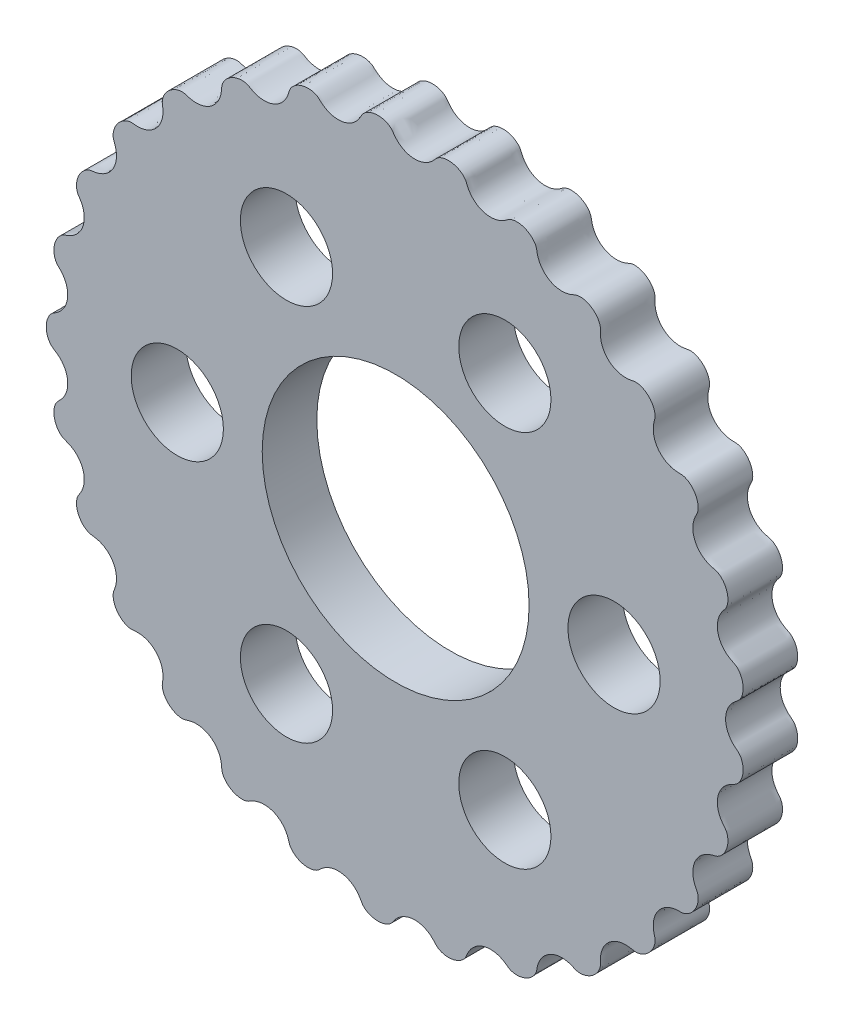
from build123d import *

# Parameters (mm, degrees)
SKETCH1_R           = 6.0325
SKETCH1_R_2         = 17.4625
BOSS_EXTRUDE1_DEPTH = 7.14375


with BuildPart() as part:
    # Sketch1 → Boss-Extrude1 (new body)
    with BuildSketch(Plane.XY):
        with BuildLine():
            add(Edge.make_bspline(
                [(43.180037539, -0.016171008), (43.180732256, -0.156720525), (43.198547592, -0.441775025), (43.275571177, -0.866849268), (43.475929503, -1.408463048), (43.758194206, -1.88996266), (44.060073392, -2.254524653), (44.342588939, -2.520531204), (44.577640295, -2.712775103), (44.773247465, -2.856854457), (44.992820418, -3.068793424), (45.176258671, -3.348075236), (45.323218913, -3.677104963), (45.446017109, -4.137904281), (45.494569855, -4.664468754), (45.431104619, -5.27645532), (45.238531318, -5.829854326), (45.002248244, -6.231904135), (44.776137553, -6.500833359), (44.602340139, -6.664063371), (44.406139199, -6.800841403), (44.189763607, -6.900940102), (43.922438765, -7.030624346), (43.654205093, -7.182908207), (43.392247616, -7.365298095), (43.088404259, -7.625181377), (42.70406512, -8.035675702), (42.358871835, -8.592317431), (42.126606325, -9.298133027), (42.069815968, -10.051474516), (42.143213989, -10.678161981), (42.323125901, -11.244812552), (42.551667666, -11.685704502), (42.778586883, -12.013421918), (42.966396025, -12.249241998), (43.125490848, -12.430917876), (43.288651248, -12.686394764), (43.434807344, -13.076931442), (43.511212195, -13.602534957), (43.456364105, -14.24321268), (43.241807953, -14.901984846), (42.943943747, -15.395026555), (42.637096026, -15.733726316), (42.370967555, -15.946365614), (42.18019639, -16.067151779), (41.975201436, -16.163357733), (41.75693081, -16.223190355), (41.536749446, -16.269477814), (41.319039979, -16.329376208), (41.092393187, -16.402087549), (40.859376877, -16.494977167), (40.560182248, -16.640203587), (40.208696047, -16.860549752), (39.837162952, -17.17242085), (39.459674393, -17.616681783), (39.153218052, -18.147312364), (38.944862936, -18.754876245), (38.860039402, -19.420822348), (38.90782701, -20.038909848), (39.035303108, -20.532258893), (39.184960629, -20.90196683), (39.309527718, -21.163729143), (39.421857135, -21.366392051), (39.533723451, -21.635210453), (39.590771181, -21.954987961), (39.594749909, -22.310994211), (39.523141254, -22.784796196), (39.348356968, -23.304571584), (39.023432953, -23.861891973), (38.602130802, -24.2956395), (38.211782612, -24.560225746), (37.906644131, -24.699926834), (37.715364341, -24.764840019), (37.517444484, -24.807630002), (37.315495158, -24.819414311), (37.114050768, -24.818030604), (36.912270333, -24.826223534), (36.627508265, -24.847246342), (36.261943448, -24.905890125), (35.824449931, -25.031540876), (35.336442821, -25.262068329), (34.866959237, -25.586186863), (34.439228163, -26.010514916), (34.081545485, -26.534354875), (33.856709216, -27.071582238), (33.74423218, -27.556088346), (33.706283949, -27.949117586), (33.70515751, -28.241561548), (33.724901916, -28.514933397), (33.76342912, -28.765873295), (33.814351358, -29.016006605), (33.883015979, -29.259962141), (33.943683971, -29.508246913), (33.953967622, -29.763845838), (33.926956816, -30.043402736), (33.856082579, -30.342474375), (33.706023606, -30.738100741), (33.436656103, -31.190671854), (33.033577179, -31.64043598), (32.570481269, -31.967121435), (32.172859705, -32.150128356), (31.862252234, -32.240651261), (31.655025839, -32.279924593), (31.444627822, -32.296721439), (31.23344544, -32.285248795), (31.026921352, -32.241999931), (30.820971552, -32.199341196), (30.600556674, -32.16287516), (30.366331589, -32.137015664), (30.052902657, -32.123555765), (29.661570124, -32.145590456), (29.211244124, -32.230269416), (28.688035269, -32.417551592), (28.176141949, -32.708112214), (27.701477403, -33.10983214), (27.346943319, -33.558754963), (27.110774429, -33.987066661), (26.944807526, -34.413463491), (26.835879347, -34.827558732), (26.788453638, -35.237853757), (26.784653574, -35.634946058), (26.808678636, -35.964618424), (26.793027936, -36.229931722), (26.719827199, -36.516728997), (26.594862869, -36.817200298), (26.41061149, -37.12218318), (26.166767262, -37.421159853), (25.892392942, -37.677747723), (25.596889536, -37.892495081), (25.287182018, -38.065259494), (24.968793214, -38.197253322), (24.637259251, -38.28933846), (24.295697914, -38.338192219), (23.951971334, -38.335510804), (23.610281781, -38.2743009), (23.315072265, -38.129974817), (23.030874128, -38.009916087), (22.688143252, -37.891707421), (22.284557779, -37.797197289), (21.801592317, -37.750627619), (21.212904977, -37.792398503), (20.605939892, -37.949484152), (20.008727748, -38.239540897), (19.526846468, -38.617479187), (19.178810079, -39.007912737), (18.947932632, -39.353522655), (18.80239977, -39.62600896), (18.660863561, -39.953966538), (18.561357778, -40.277229296), (18.489927946, -40.6070512), (18.440677767, -40.941313977), (18.354332871, -41.198930907), (18.207728603, -41.467582588), (18.002695856, -41.740027329), (17.733567501, -42.00331966), (17.40084439, -42.244704065), (16.957255124, -42.479489789), (16.483479522, -42.631888281), (15.99631956, -42.69784861), (15.542982384, -42.672876852), (15.223330542, -42.606950322), (14.944812927, -42.504870099), (14.716213267, -42.367922077), (14.509218278, -42.202328474), (14.289692169, -42.053483722), (14.063745742, -41.914887442), (13.826950132, -41.79510958), (13.568328375, -41.686718641), (13.286832851, -41.596277845), (12.903718763, -41.510579536), (12.415425206, -41.467308184), (11.843432661, -41.51167776), (11.244603196, -41.682261887), (10.718022482, -41.945766829), (10.271629738, -42.275557887), (9.951157305, -42.601373684), (9.71527865, -42.913017879), (9.551931662, -43.17983187), (9.442973852, -43.387921897), (9.350192269, -43.590358043), (9.270616777, -43.784203123), (9.189982201, -43.978429963), (9.079982843, -44.158192239), (8.947815845, -44.321717357), (8.798926417, -44.470089616), (8.549980836, -44.674906608), (8.176039539, -44.899769579), (7.646366587, -45.098646483), (7.047915931, -45.17922452), (6.521998337, -45.147375771), (6.046765759, -45.033795333), (5.7039521, -44.888128032), (5.412591508, -44.696704275), (5.197664214, -44.458546216), (5.034301852, -44.264448841), (4.854457741, -44.081900373), (4.667786905, -43.909209119), (4.451308161, -43.739682049), (4.207535591, -43.576870138), (3.859254952, -43.388478824), (3.393149504, -43.211079404), (2.820196018, -43.097982629), (2.184979426, -43.103322055), (1.594300057, -43.222371866), (1.064432533, -43.431479243), (0.602495875, -43.707243919), (0.255268685, -43.999288892), (0.003264965, -44.268907232), (-0.172736489, -44.492621654), (-0.292127839, -44.654659877), (-0.403519112, -44.821813054), (-0.527320348, -44.981011935), (-0.674103885, -45.119552691), (-0.83516208, -45.240392421), (-1.121726033, -45.41305447), (-1.558791141, -45.586100315), (-2.153586466, -45.690385536), (-2.796737391, -45.645822554), (-3.325328371, -45.498030344), (-3.758409828, -45.289965509), (-4.051277822, -45.085597139), (-4.283528187, -44.857229089), (-4.442571331, -44.612217185), (-4.546898542, -44.40469493), (-4.666176505, -44.204802082), (-4.792023432, -44.009416939), (-4.99663872, -43.73559526), (-5.303181449, -43.40394273), (-5.745653731, -43.054994921), (-6.347098729, -42.753213686), (-6.968997495, -42.587810385), (-7.580364356, -42.546918667), (-8.158901061, -42.613055327), (-8.623451492, -42.747325637), (-9.001288501, -42.915719611), (-9.287868995, -43.082449393), (-9.494419501, -43.223446777), (-9.680710334, -43.370382107), (-9.851693649, -43.516689999), (-10.01266255, -43.672906463), (-10.185226637, -43.818254388), (-10.379822164, -43.932471103), (-10.586587837, -44.021459188), (-10.829539238, -44.095992259), (-11.107937654, -44.148356665), (-11.50474109, -44.176026154), (-12.019279583, -44.128864319), (-12.602129156, -43.959887322), (-13.163530105, -43.64456311), (-13.555877247, -43.284432842), (-13.796634042, -42.94254654), (-13.914977796, -42.662733731), (-13.975956971, -42.428578463), (-14.066516097, -42.140285409), (-14.211734025, -41.767928489), (-14.450516805, -41.330783639), (-14.8215104, -40.863806074), (-15.302532397, -40.452116816), (-15.951915969, -40.084280412), (-16.651730137, -39.885620849), (-17.35511176, -39.853345855), (-17.947165062, -39.955679245), (-18.317756531, -40.070765846), (-18.605284355, -40.19029888), (-18.815703294, -40.29522275), (-19.022261204, -40.407437888), (-19.22099941, -40.533354976), (-19.489877553, -40.655543439), (-19.811544832, -40.726082278), (-20.172572708, -40.744015649), (-20.655997473, -40.690097459), (-21.184599966, -40.534140114), (-21.751983016, -40.231498845), (-22.24871682, -39.784885468), (-22.555614534, -39.33887883), (-22.710618323, -38.952301006), (-22.761786732, -38.664098975), (-22.769100022, -38.430935469), (-22.791665739, -38.199140048), (-22.821556602, -37.968019918), (-22.885272245, -37.650591129), (-23.005748151, -37.253573401), (-23.220131195, -36.793697715), (-23.565769264, -36.305495121), (-24.094818523, -35.789859648), (-24.730837757, -35.414231996), (-25.433464775, -35.201077776), (-26.13317853, -35.157872253), (-26.602784484, -35.204568044), (-26.980172383, -35.289886774), (-27.270319444, -35.376897065), (-27.498871758, -35.457674538), (-27.797234291, -35.518256805), (-28.130348001, -35.512261831), (-28.484034056, -35.448394361), (-28.932712272, -35.291041267), (-29.39493714, -35.035378795), (-29.865560066, -34.638748932), (-30.215252137, -34.167768335), (-30.415116481, -33.744934569), (-30.509985155, -33.405648377), (-30.546818086, -33.16944569), (-30.548370037, -32.92969174), (-30.509038093, -32.694009025), (-30.466816428, -32.399129153), (-30.442999743, -32.090761089), (-30.447963238, -31.770632214), (-30.494083089, -31.372144448), (-30.620807279, -30.822151469), (-30.891215717, -30.224121257), (-31.348446993, -29.63776838), (-31.942064335, -29.171451668), (-32.501334301, -28.884042602), (-33.070129399, -28.717654752), (-33.5619975, -28.661143206), (-33.959518376, -28.666020427), (-34.259349803, -28.689663621), (-34.498573325, -28.719014801), (-34.800859124, -28.708768614), (-35.204676688, -28.609495771), (-35.680722167, -28.377264603), (-36.179010237, -27.972171902), (-36.603258711, -27.424331219), (-36.843757021, -26.900052702), (-36.951248767, -26.454299667), (-36.976886001, -26.113507364), (-36.96884724, -25.887097507), (-36.932077181, -25.662867601), (-36.857281806, -25.448470733), (-36.772442124, -25.239359931), (-36.699785817, -25.024745341), (-36.614237703, -24.728919287), (-36.541184271, -24.345182483), (-36.512950635, -23.872361671), (-36.572531388, -23.319618487), (-36.724626395, -22.782320994), (-36.966872183, -22.276329711), (-37.29365344, -21.817136746), (-37.69641591, -21.418921273), (-38.157695082, -21.098354611), (-38.661836076, -20.860853315), (-39.127609879, -20.728516332), (-39.532268319, -20.663148513), (-39.872442624, -20.631717807), (-40.137980324, -20.560920441), (-40.409501926, -20.431993437), (-40.681841236, -20.252019741), (-40.945365601, -20.016779468), (-41.191061737, -19.728198567), (-41.43631476, -19.348971614), (-41.648573663, -18.86867991), (-41.75769213, -18.393863753), (-41.775191398, -17.948366049), (-41.737324922, -17.618251361), (-41.689799532, -17.403228614), (-41.617456128, -17.194769573), (-41.513994331, -16.999783372), (-41.387377102, -16.819611474), (-41.270936214, -16.633230895), (-41.154578009, -16.432065871), (-41.046154904, -16.212550768), (-40.922884701, -15.912090838), (-40.809057944, -15.523220987), (-40.738194022, -15.054837461), (-40.745999695, -14.483513178), (-40.860279597, -13.892032203), (-41.095833989, -13.304095214), (-41.415625027, -12.819321102), (-41.754096485, -12.456720677), (-42.058173371, -12.206511163), (-42.299538017, -12.042781671), (-42.536602293, -11.906640089), (-42.765740028, -11.798853542), (-43.000780884, -11.701010479), (-43.24093738, -11.621959268), (-43.479340465, -11.531620295), (-43.695438614, -11.396020737), (-43.910506156, -11.216552759), (-44.117118209, -10.990143107), (-44.359040339, -10.644407669), (-44.581619193, -10.167647422), (-44.727121043, -9.581119357), (-44.737690285, -8.960559315), (-44.643774815, -8.476328513), (-44.505062643, -8.124377526), (-44.373426599, -7.894913072), (-44.244006528, -7.726968739), (-44.091382363, -7.580485398), (-43.940485278, -7.433279802), (-43.786347032, -7.270566105), (-43.633664803, -7.090174521), (-43.446749007, -6.836853072), (-43.245989981, -6.498634037), (-43.064494532, -6.076064636), (-42.928353108, -5.536322454), (-42.884569294, -4.949193975), (-42.953787213, -4.332185716), (-43.128274442, -3.788837521), (-43.351563054, -3.35532587), (-43.574189666, -3.03442787), (-43.762980005, -2.8088328), (-43.959659448, -2.610872873), (-44.158597212, -2.437253557), (-44.370729753, -2.280350737), (-44.589717627, -2.133210944), (-44.819237553, -2.00279529), (-45.027946151, -1.839150875), (-45.223290975, -1.61799747), (-45.400414328, -1.345864091), (-45.548580497, -1.022906653), (-45.662830498, -0.638584407), (-45.707797041, -0.33672715), (-45.719322165, -0.128747099), (-45.719945311, -0.016648341), (-45.719960735, -0.01387366), (-45.719972737, -0.011098961), (-45.719989886, -0.005549522), (-45.719993317, 0), (-45.719989889, 0.005549521), (-45.719972742, 0.01109896), (-45.719960743, 0.01387366), (-45.71994532, 0.01664834), (-45.719322229, 0.128747622), (-45.707797135, 0.336728202), (-45.662830533, 0.638585986), (-45.548580314, 1.022908715), (-45.400414087, 1.345866127), (-45.223290685, 1.617999474), (-45.027945822, 1.839152844), (-44.819237194, 2.002797221), (-44.589717244, 2.133212834), (-44.370729345, 2.280352588), (-44.158596776, 2.43725537), (-43.95965898, 2.610874651), (-43.762979502, 2.808834542), (-43.574189122, 3.034429579), (-43.351562452, 3.355327539), (-43.128273763, 3.788839149), (-42.953786437, 4.332187313), (-42.884568407, 4.949195559), (-42.928352116, 5.536324046), (-43.064493443, 6.076066253), (-43.245988816, 6.498635687), (-43.446747781, 6.836854757), (-43.633663532, 7.09017624), (-43.786345729, 7.270567851), (-43.940483946, 7.433281576), (-44.091381004, 7.580487198), (-44.244005143, 7.726970567), (-44.373425184, 7.894914924), (-44.505061187, 8.124379401), (-44.643773296, 8.476330413), (-44.737688679, 8.960561232), (-44.727119326, 9.581121271), (-44.581617371, 10.167649311), (-44.359038431, 10.644409518), (-44.117116239, 10.990144912), (-43.910504146, 11.216554527), (-43.695436571, 11.396022467), (-43.479338398, 11.531621986), (-43.240935297, 11.621960917), (-43.000778786, 11.701012084), (-42.765737914, 11.798855105), (-42.536600159, 11.906641611), (-42.299535859, 12.042783151), (-42.058171183, 12.2065126), (-41.754094252, 12.456722059), (-41.415622729, 12.819322423), (-41.095831604, 13.304096478), (-40.860277107, 13.892033425), (-40.745997099, 14.48351438), (-40.738191324, 15.054838661), (-40.809055161, 15.523222199), (-40.922881849, 15.912092071), (-41.046151998, 16.212552023), (-41.154575063, 16.432067146), (-41.270933233, 16.63323219), (-41.387374087, 16.81961279), (-41.513991284, 16.999784711), (-41.617453046, 17.19477093), (-41.689796413, 17.403229985), (-41.737321764, 17.61825274), (-41.775188181, 17.948367435), (-41.757688833, 18.393865135), (-41.648570281, 18.868681273), (-41.436311292, 19.348972939), (-41.191058201, 19.728199848), (-40.945362013, 20.016780705), (-40.681837606, 20.252020931), (-40.409498264, 20.431994578), (-40.137976639, 20.560921533), (-39.872438926, 20.631718852), (-39.532264616, 20.663149497), (-39.127606164, 20.728517243), (-38.661832337, 20.860854143), (-38.1576913, 21.098355349), (-37.696412071, 21.418921928), (-37.293649529, 21.817137329), (-36.966868191, 22.276330234), (-36.724622312, 22.782321475), (-36.572527208, 23.31961894), (-36.512946356, 23.872362113), (-36.541179907, 24.345182931), (-36.61423327, 24.728919748), (-36.699781331, 25.024745817), (-36.7724376, 25.23936042), (-36.857277244, 25.448471237), (-36.932072581, 25.662868119), (-36.9688426, 25.887098031), (-36.976881321, 26.11350789), (-36.951244025, 26.454300188), (-36.843752199, 26.900053204), (-36.603253796, 27.424331678), (-36.179005223, 27.972172285), (-35.680717081, 28.377264896), (-35.20467156, 28.60949598), (-34.800853979, 28.70876875), (-34.498568177, 28.719014883), (-34.25934466, 28.68966366), (-33.959513238, 28.666020412), (-33.561992363, 28.661143119), (-33.070124251, 28.717654577), (-32.501329124, 28.884042325), (-31.942059107, 29.171451291), (-31.348441681, 29.637767897), (-30.891210299, 30.224120692), (-30.620801755, 30.822150856), (-30.494077466, 31.372143812), (-30.447957543, 31.770631569), (-30.442993991, 32.090760444), (-30.466810621, 32.399128512), (-30.509032233, 32.694008392), (-30.548364135, 32.929691113), (-30.546812141, 33.169445063), (-30.509979167, 33.405647744), (-30.415110433, 33.744933919), (-30.215246012, 34.167767649), (-29.865553857, 34.638748183), (-29.39493086, 35.035377962), (-28.932705946, 35.291040351), (-28.484027702, 35.448393364), (-28.130341636, 35.512260771), (-27.797227925, 35.518255686), (-27.498865402, 35.457673364), (-27.270313103, 35.376895851), (-26.980166057, 35.289885508), (-26.602778174, 35.20456671), (-26.133172228, 35.157870835), (-25.433458466, 35.201076232), (-24.730831409, 35.414230327), (-24.094812108, 35.789857864), (-23.565762756, 36.305493243), (-23.2201246, 36.793695775), (-23.005741474, 37.253571423), (-22.885265496, 37.650589129), (-22.821549797, 37.968017907), (-22.791658892, 38.199138032), (-22.769093134, 38.430933449), (-22.761779802, 38.664096953), (-22.710611341, 38.952298974), (-22.555607483, 39.338876771), (-22.248709689, 39.784883354), (-21.751975805, 40.231496641), (-21.184592701, 40.534137809), (-20.65599018, 40.690095059), (-20.172565405, 40.744013162), (-19.811537532, 40.726079727), (-19.489870266, 40.655540831), (-19.220992145, 40.53335232), (-19.022253961, 40.407435196), (-18.815696072, 40.29522002), (-18.605277151, 40.190296113), (-18.317749349, 40.070763028), (-17.9471579, 39.95567636), (-17.355104617, 39.853342863), (-16.651722988, 39.885617732), (-15.951908784, 40.084277169), (-15.302525147, 40.452113457), (-14.821503076, 40.863802628), (-14.450509396, 41.330780127), (-14.211726539, 41.767924935), (-14.066508544, 42.140281828), (-13.975949367, 42.428574866), (-13.91497015, 42.662730123), (-13.796626345, 42.942542911), (-13.555869489, 43.28442917), (-13.163522283, 43.644559368), (-12.602121277, 43.959883479), (-12.019271674, 44.128860372), (-11.504733172, 44.176022114), (-11.107929741, 44.148352554), (-10.829531334, 44.095988098), (-10.586579947, 44.021454984), (-10.379814289, 43.932466862), (-10.185218783, 43.818250112), (-10.012654722, 43.672902156), (-9.851685849, 43.516685663), (-9.68070256, 43.37037774), (-9.494411754, 43.223442377), (-9.287861273, 43.082444956), (-9.001280809, 42.915715123), (-8.62344383, 42.747321081), (-8.158893423, 42.613050688), (-7.58035673, 42.546913924), (-6.968989861, 42.587805532), (-6.347091066, 42.753208722), (-5.745646014, 43.054989849), (-5.303173669, 43.403937579), (-4.99663088, 43.735590053), (-4.792015544, 44.009411696), (-4.666168582, 44.204796817), (-4.546890583, 44.404689643), (-4.442563335, 44.612211879), (-4.283520147, 44.857223755), (-4.051269741, 45.085591763), (-3.75840171, 45.28996008), (-3.325320216, 45.498024838), (-2.796729209, 45.645816954), (-2.153578277, 45.69037982), (-1.55878297, 45.586094493), (-1.121717893, 45.413048569), (-0.835153971, 45.240386469), (-0.674095798, 45.11954671), (-0.527312286, 44.981005927), (-0.403511079, 44.821807024), (-0.292119835, 44.654653827), (-0.172728514, 44.492615583), (0.0032729, 44.26890113), (0.255276571, 43.999282744), (0.602503709, 43.707237709), (1.064440317, 43.43147295), (1.594307804, 43.222365478), (2.184987152, 43.103315562), (2.820203743, 43.097976021), (3.393157249, 43.211072694), (3.859262729, 43.388472031), (4.207543401, 43.576863282), (4.451316001, 43.739675149), (4.667794776, 43.909202181), (4.854465642, 44.081893401), (5.034309786, 44.264441837), (5.197672183, 44.458539182), (5.41259952, 44.696697203), (5.703960146, 44.888120908), (6.046773831, 45.033788147), (6.522006429, 45.1473685), (7.047924029, 45.179217155), (7.64637467, 45.098639011), (8.176047587, 44.899762011), (8.549988844, 44.674898973), (8.798934388, 44.470081937), (8.947823789, 44.321709651), (9.079990758, 44.158184509), (9.189990084, 43.978422214), (9.270624625, 43.784195359), (9.350200082, 43.590350265), (9.442981629, 43.387914103), (9.551939402, 43.179824056), (9.715286342, 42.913010036), (9.951164941, 42.601365799), (10.271637316, 42.275549944), (10.718030001, 41.945758806), (11.244610667, 41.68225377), (11.843440101, 41.511669535), (12.415432639, 41.467299856), (12.903726203, 41.510571121), (13.286840307, 41.596269362), (13.568335847, 41.686710107), (13.826957623, 41.795101), (14.063753255, 41.914878819), (14.289699706, 42.053475058), (14.509225842, 42.202319772), (14.716220861, 42.367913338), (14.944820545, 42.504861318), (15.223338179, 42.606941492), (15.542990032, 42.672867964), (15.996327214, 42.697839641), (16.483487164, 42.631879225), (16.957262738, 42.479480648), (17.400851962, 42.244694844), (17.73357503, 42.003310379), (18.002703337, 41.740018), (18.207736036, 41.467573223), (18.354340256, 41.198921515), (18.440685105, 40.94130457), (18.489935224, 40.607041784), (18.561364997, 40.277219867), (18.660870722, 39.953957091), (18.802406872, 39.625999488), (18.947939686, 39.353513157), (19.178817071, 39.007903197), (19.52685339, 38.617469585), (20.008734602, 38.239531209), (20.605946694, 37.949474357), (21.212911751, 37.792388599), (21.801599084, 37.750617609), (22.284564554, 37.797187192), (22.688150044, 37.891697253), (23.030880941, 38.009905857), (23.315079099, 38.129964536), (23.610288642, 38.274290567), (23.951978206, 38.335500409), (24.295704785, 38.338181762), (24.637266114, 38.289327942), (24.96880006, 38.197242745), (25.287188841, 38.06524886), (25.596896328, 37.892484391), (25.892399696, 37.67773698), (26.16677397, 37.421149061), (26.410618144, 37.122172344), (26.594869468, 36.817189429), (26.719833745, 36.516718106), (26.79303443, 36.229920818), (26.808685083, 35.964607517), (26.784659962, 35.634935155), (26.788459954, 35.237842853), (26.835885589, 34.827547819), (26.944813694, 34.413452559), (27.110780521, 33.987055699), (27.346949334, 33.558743959), (27.701483338, 33.109821073), (28.176147812, 32.708101062), (28.688041079, 32.417540348), (29.2112499, 32.230258078), (29.661575886, 32.145579038), (30.052908414, 32.123544276), (30.366337349, 32.137004119), (30.600562438, 32.162863573), (30.820977324, 32.19932957), (31.026927131, 32.241988268), (31.233451227, 32.285237094), (31.444633611, 32.296709701), (31.655031624, 32.279912817), (31.862258013, 32.240639448), (32.172865467, 32.150116488), (32.570486999, 31.967109495), (33.03358285, 31.640423958), (33.436661693, 31.190659758), (33.706029116, 30.738088598), (33.856088017, 30.342462205), (33.926962201, 30.043390553), (33.953972956, 29.76383365), (33.94368926, 29.508234727), (33.883021223, 29.259949966), (33.814356559, 29.015994442), (33.763434276, 28.765861141), (33.724907027, 28.51492125), (33.705162572, 28.241549404), (33.706288959, 27.949105442), (33.744237119, 27.556076195), (33.856714068, 27.071570067), (34.081550241, 26.534342664), (34.439232825, 26.010502641), (34.866963823, 25.586174511), (35.336447349, 25.262055894), (35.824454418, 25.031528352), (36.261947912, 24.905877523), (36.627512719, 24.847233675), (36.912274783, 24.826210816), (37.114055217, 24.818017849), (37.315499607, 24.819401521), (37.517448931, 24.807617176), (37.71536878, 24.764827157), (37.906648559, 24.699913938), (38.211787014, 24.560212795), (38.602135157, 24.295626479), (39.02343723, 23.861878876), (39.348361146, 23.304558429), (39.523145338, 22.78478301), (39.594753908, 22.310981012), (39.590775116, 21.954974763), (39.533727329, 21.635197265), (39.421860964, 21.366378883), (39.309531511, 21.163715995), (39.184964375, 20.901953704), (39.035306788, 20.532245794), (38.907830602, 20.038896773), (38.860042883, 19.420809281), (38.944866298, 18.754863162), (39.153221305, 18.147299244), (39.45967755, 17.616668608), (39.83716603, 17.172407607), (40.208699069, 16.860536443), (40.560185231, 16.640190215), (40.859379833, 16.494963741), (41.092396127, 16.402074081), (41.319042906, 16.3293627), (41.536752362, 16.269464267), (41.756933718, 16.223176768), (41.975204333, 16.163344107), (42.18019927, 16.067138117), (42.370970413, 15.946351918), (42.637098846, 15.733712572), (42.943946507, 15.395012756), (43.241810624, 14.901970993), (43.456366658, 14.243198789), (43.511214633, 13.602521056), (43.434809688, 13.076917555), (43.288653522, 12.686380903), (43.125493076, 12.430904044), (42.96639822, 12.249228195), (42.778589036, 12.013408148), (42.551669761, 11.685690773), (42.323127916, 11.244798864), (42.143215903, 10.678148326), (42.06981777, 10.051460873), (42.126607991, 9.298119374), (42.358873375, 8.592303737), (42.70406656, 8.035661946), (43.088405625, 7.625167552), (43.392248936, 7.365284215), (43.654206381, 7.182894281), (43.922440026, 7.030610371), (44.189764844, 6.90092608), (44.406140418, 6.800827341), (44.602341334, 6.664049275), (44.776138718, 6.500819231), (45.002249361, 6.231889967), (45.238532363, 5.829840115), (45.431105565, 5.276441075), (45.494570691, 4.664454498), (45.446017851, 4.137890033), (45.323219572, 3.677090737), (45.176259271, 3.348061036), (44.992820968, 3.068779257), (44.773247977, 2.85684033), (44.577640781, 2.712761011), (44.342589391, 2.520517154), (44.060073796, 2.254510653), (43.758194545, 1.889948715), (43.475929755, 1.408449153), (43.275572538, 0.866838667), (43.198548909, 0.441768011), (43.180732931, 0.15671703), (43.18003761, 0.016170926), (43.180024276, 0.013475798), (43.180013916, 0.010780655), (43.179999125, 0.005390339), (43.179996158, -4.1e-08), (43.179999102, -0.00539042), (43.180013869, -0.010780737), (43.180024217, -0.01347588), (43.180037539, -0.016171008)],
                knots=[0, 0, 0, 0, 0, 0.001706475, 0.003461992, 0.00521751, 0.006973027, 0.008447185, 0.009184264, 0.009921343, 0.010658422, 0.011395501, 0.012869659, 0.013943322, 0.015016984, 0.017164309, 0.019254978, 0.021345646, 0.022067516, 0.022789385, 0.023511255, 0.024233125, 0.024954995, 0.025676865, 0.027120605, 0.027971561, 0.028822518, 0.030524431, 0.033928257, 0.035831367, 0.037734477, 0.039637587, 0.041540697, 0.043004809, 0.043736865, 0.044468921, 0.045200977, 0.045933033, 0.047397145, 0.049493999, 0.051590852, 0.053665001, 0.05573915, 0.056423288, 0.057107426, 0.057791564, 0.058475703, 0.059159841, 0.059843979, 0.060528117, 0.061212256, 0.062049345, 0.062886435, 0.064560614, 0.066234793, 0.067908972, 0.069931858, 0.071954743, 0.073977629, 0.076000514, 0.077407373, 0.078110803, 0.078814232, 0.079517661, 0.080221091, 0.08162795, 0.082725219, 0.083822488, 0.086017027, 0.088247514, 0.090478001, 0.091090168, 0.091702334, 0.092314501, 0.092926667, 0.093538834, 0.094151001, 0.094763167, 0.095375334, 0.097005644, 0.098635953, 0.100266263, 0.101896573, 0.103902168, 0.105907763, 0.107913357, 0.108916154, 0.109918952, 0.11069079, 0.111462628, 0.112234467, 0.113006305, 0.113778143, 0.114549982, 0.11532182, 0.116093659, 0.117181169, 0.118268679, 0.120443699, 0.12244797, 0.124452242, 0.125091335, 0.125730429, 0.126369522, 0.127008615, 0.127647708, 0.128286802, 0.128925895, 0.129564988, 0.130356232, 0.131147476, 0.132729964, 0.134312451, 0.135894939, 0.137866232, 0.139837525, 0.141808817, 0.142794464, 0.14378011, 0.145384697, 0.146989284, 0.147791578, 0.148593871, 0.149396164, 0.150198458, 0.151366398, 0.152534337, 0.153702277, 0.154870217, 0.155913342, 0.156956468, 0.157999593, 0.159042719, 0.160084075, 0.16112543, 0.162166786, 0.163208142, 0.164045417, 0.164882692, 0.166557242, 0.168231792, 0.169906341, 0.172014084, 0.174121826, 0.176229568, 0.17728344, 0.178337311, 0.179156448, 0.179975586, 0.18161386, 0.182432998, 0.183252135, 0.184071272, 0.18489041, 0.186134207, 0.187378005, 0.188621802, 0.1898656, 0.192207634, 0.19337865, 0.194549667, 0.195353897, 0.196158127, 0.196962357, 0.197766588, 0.198570818, 0.199375048, 0.200179278, 0.200983508, 0.201971713, 0.202959919, 0.20493633, 0.206912741, 0.208889152, 0.210467352, 0.212045551, 0.21362375, 0.21441285, 0.215201949, 0.215838754, 0.21647556, 0.217112365, 0.21774917, 0.218385976, 0.219022781, 0.219659586, 0.220296391, 0.222294246, 0.2242921, 0.226473114, 0.22756362, 0.228654127, 0.230201775, 0.230975599, 0.231749423, 0.232523247, 0.233297071, 0.234070895, 0.234844719, 0.235850239, 0.236855759, 0.238866799, 0.240877838, 0.242888878, 0.244514006, 0.246139133, 0.24776426, 0.249389387, 0.249999634, 0.250609882, 0.251220129, 0.251830376, 0.252440624, 0.253050871, 0.253661118, 0.254271366, 0.256495071, 0.258718777, 0.260919257, 0.262019496, 0.263119736, 0.264530732, 0.265236229, 0.265941727, 0.266647224, 0.267352722, 0.26805822, 0.268763717, 0.27079217, 0.272820622, 0.274849075, 0.276877527, 0.278546797, 0.280216068, 0.281885338, 0.282719974, 0.283554609, 0.284236507, 0.284918406, 0.285600304, 0.286282203, 0.286964101, 0.287646, 0.288327898, 0.289009797, 0.290043585, 0.291077374, 0.293144951, 0.295248072, 0.297351192, 0.298818583, 0.299552278, 0.300285973, 0.301019668, 0.301753363, 0.303220753, 0.305130286, 0.307039818, 0.308949351, 0.310858884, 0.314132818, 0.315769785, 0.317406752, 0.318120072, 0.318833393, 0.319546713, 0.320260033, 0.320973354, 0.321686674, 0.323113315, 0.3242278, 0.325342286, 0.327571256, 0.32976424, 0.331957223, 0.333371139, 0.334078097, 0.334785055, 0.335492013, 0.336198971, 0.336905929, 0.337612887, 0.339418615, 0.341224342, 0.34303007, 0.344835798, 0.34833469, 0.350084136, 0.351833582, 0.353304176, 0.354039473, 0.35477477, 0.355510068, 0.356245365, 0.357715959, 0.358786364, 0.359856769, 0.361997579, 0.364094373, 0.366191167, 0.366914825, 0.367638482, 0.36836214, 0.369085797, 0.369809454, 0.370533112, 0.371980426, 0.372834489, 0.373688552, 0.375396677, 0.378812927, 0.380709585, 0.382606243, 0.384502902, 0.38639956, 0.387860421, 0.388590851, 0.389321282, 0.390051713, 0.390782143, 0.392243004, 0.394333569, 0.396424135, 0.398504851, 0.400585568, 0.401271973, 0.401958378, 0.402644784, 0.403331189, 0.404017594, 0.404704, 0.405390405, 0.40607681, 0.407755868, 0.409434927, 0.411113985, 0.412793043, 0.414502877, 0.41621271, 0.417922544, 0.419632377, 0.42128962, 0.422946863, 0.423775484, 0.424604106, 0.425432727, 0.426261348, 0.427408778, 0.428556208, 0.429703637, 0.430851067, 0.432875588, 0.434900109, 0.435567407, 0.436234705, 0.436902003, 0.4375693, 0.438236598, 0.438903896, 0.439571194, 0.440238492, 0.441056222, 0.441873952, 0.443509413, 0.445144873, 0.446780333, 0.448780456, 0.450780578, 0.452780701, 0.453780762, 0.454780824, 0.455550681, 0.456320538, 0.457090396, 0.457860253, 0.458630111, 0.459399968, 0.460169826, 0.460939683, 0.462024179, 0.463108675, 0.465277667, 0.467288367, 0.469299066, 0.470580556, 0.471221301, 0.471862046, 0.472502791, 0.473143536, 0.473784281, 0.474425026, 0.47521907, 0.476013113, 0.477601201, 0.479189288, 0.480777375, 0.48274351, 0.484709646, 0.486675782, 0.48765885, 0.488641917, 0.489442283, 0.490242649, 0.491043015, 0.491843381, 0.492643747, 0.493444113, 0.494244479, 0.495044845, 0.496209684, 0.497374523, 0.498539362, 0.499900396, 0.499900396, 0.499900396, 0.499900396, 0.499934085, 0.499934085, 0.499967773, 0.499967773, 0.500001462, 0.500001462, 0.500001462, 0.500001462, 0.501362502, 0.502527341, 0.50369218, 0.50485702, 0.505657386, 0.506457751, 0.507258117, 0.508058483, 0.508858849, 0.509659215, 0.510459581, 0.511259947, 0.512243015, 0.513226083, 0.515192218, 0.517158354, 0.51912449, 0.520712577, 0.522300664, 0.523888751, 0.524682794, 0.525476838, 0.526117583, 0.526758328, 0.527399073, 0.528039818, 0.528680563, 0.529321308, 0.530602798, 0.532613498, 0.534624197, 0.536793189, 0.537877685, 0.538962181, 0.539732039, 0.540501896, 0.541271753, 0.542041611, 0.542811468, 0.543581326, 0.544351183, 0.545121041, 0.546121102, 0.547121163, 0.549121286, 0.551121409, 0.553121531, 0.554756991, 0.556392452, 0.558027912, 0.558845642, 0.559663372, 0.56033067, 0.560997968, 0.561665266, 0.562332564, 0.562999862, 0.56366716, 0.564334458, 0.565001756, 0.567026276, 0.569050797, 0.570198227, 0.571345657, 0.572493086, 0.573640516, 0.574469137, 0.575297759, 0.57612638, 0.576955002, 0.578612244, 0.580269487, 0.581979321, 0.583689154, 0.585398988, 0.587108821, 0.588787879, 0.590466938, 0.592145996, 0.593825054, 0.594511459, 0.595197865, 0.59588427, 0.596570675, 0.597257081, 0.597943486, 0.598629891, 0.599316296, 0.601397013, 0.60347773, 0.605568295, 0.60765886, 0.609119721, 0.609850152, 0.610580582, 0.611311013, 0.612041443, 0.613502305, 0.615398963, 0.617295621, 0.619192279, 0.621088937, 0.624505188, 0.626213313, 0.627067375, 0.627921438, 0.629368753, 0.63009241, 0.630816067, 0.631539725, 0.632263382, 0.632987039, 0.633710697, 0.635807491, 0.637904285, 0.640045096, 0.641115501, 0.642185906, 0.6436565, 0.644391797, 0.645127094, 0.645862391, 0.646597688, 0.648068282, 0.649817728, 0.651567174, 0.655066066, 0.656871794, 0.658677522, 0.66048325, 0.662288978, 0.662995936, 0.663702893, 0.664409851, 0.665116809, 0.665823767, 0.666530725, 0.667944641, 0.670137625, 0.672330608, 0.674559579, 0.675674064, 0.676788549, 0.67821519, 0.67892851, 0.679641831, 0.680355151, 0.681068472, 0.681781792, 0.682495112, 0.684132079, 0.685769046, 0.68904298, 0.690952513, 0.692862046, 0.694771579, 0.696681111, 0.698148501, 0.698882197, 0.699615892, 0.700349587, 0.701083282, 0.702550672, 0.704653793, 0.706756913, 0.70882449, 0.709858279, 0.710892068, 0.711573966, 0.712255864, 0.712937763, 0.713619661, 0.71430156, 0.714983458, 0.715665357, 0.716347255, 0.717181891, 0.718016526, 0.719685796, 0.721355067, 0.723024337, 0.72505279, 0.727081242, 0.729109695, 0.731138147, 0.731843645, 0.732549142, 0.73325464, 0.733960137, 0.734665635, 0.735371133, 0.736782128, 0.737882368, 0.738982608, 0.741183088, 0.743406793, 0.745630498, 0.746240746, 0.746850993, 0.747461241, 0.748071488, 0.748681735, 0.749291983, 0.74990223, 0.750512477, 0.752137604, 0.753762732, 0.755387859, 0.757012986, 0.759024026, 0.761035066, 0.763046106, 0.764051626, 0.765057146, 0.76583097, 0.766604793, 0.767378617, 0.768152441, 0.768926265, 0.769700089, 0.771247737, 0.772338244, 0.773428751, 0.775609765, 0.777607619, 0.779605473, 0.780242278, 0.780879083, 0.781515889, 0.782152694, 0.782789499, 0.783426305, 0.78406311, 0.784699915, 0.785489015, 0.786278114, 0.787856313, 0.789434513, 0.791012712, 0.792989123, 0.794965534, 0.796941945, 0.797930151, 0.798918357, 0.799722587, 0.800526817, 0.801331047, 0.802135277, 0.802939507, 0.803743737, 0.804547967, 0.805352197, 0.806523214, 0.807694231, 0.810036264, 0.811280062, 0.812523859, 0.813767657, 0.815011455, 0.815830592, 0.816649729, 0.817468867, 0.818288004, 0.819926279, 0.820745416, 0.821564553, 0.822618425, 0.823672296, 0.825780038, 0.82788778, 0.829995523, 0.831670073, 0.833344622, 0.835019172, 0.835856447, 0.836693722, 0.837735078, 0.838776434, 0.83981779, 0.840859146, 0.841902271, 0.842945397, 0.843988522, 0.845031647, 0.846199587, 0.847367527, 0.848535467, 0.849703406, 0.8505057, 0.851307993, 0.852110287, 0.85291258, 0.854517167, 0.856121754, 0.8571074, 0.858093047, 0.86006434, 0.862035632, 0.864006925, 0.865589413, 0.867171901, 0.868754388, 0.869545632, 0.870336876, 0.870975969, 0.871615063, 0.872254156, 0.872893249, 0.873532342, 0.874171436, 0.874810529, 0.875449622, 0.877453894, 0.879458166, 0.881633186, 0.882720696, 0.883808206, 0.884580044, 0.885351882, 0.886123721, 0.886895559, 0.887667397, 0.888439236, 0.889211074, 0.889982912, 0.89098571, 0.891988507, 0.893994102, 0.895999696, 0.898005291, 0.899635601, 0.901265911, 0.902896221, 0.904526531, 0.905138697, 0.905750864, 0.90636303, 0.906975197, 0.907587363, 0.90819953, 0.908811697, 0.909423863, 0.91165435, 0.913884838, 0.916079376, 0.917176645, 0.918273915, 0.919680773, 0.920384203, 0.921087632, 0.921791062, 0.922494491, 0.92390135, 0.925924236, 0.927947121, 0.929970006, 0.931992892, 0.933667071, 0.93534125, 0.93701543, 0.937852519, 0.938689609, 0.939373747, 0.940057885, 0.940742023, 0.941426162, 0.9421103, 0.942794438, 0.943478576, 0.944162715, 0.946236863, 0.948311012, 0.950407866, 0.952504719, 0.953968831, 0.954700887, 0.955432943, 0.956164999, 0.956897055, 0.958361167, 0.960264277, 0.962167387, 0.964070497, 0.965973607, 0.969377433, 0.971079346, 0.971930303, 0.972781259, 0.974224999, 0.974946869, 0.975668739, 0.976390609, 0.977112479, 0.977834349, 0.978556219, 0.980646887, 0.982737555, 0.98488488, 0.985958543, 0.987032205, 0.988506363, 0.989243442, 0.989980521, 0.9907176, 0.991454679, 0.992928837, 0.994684354, 0.996439872, 0.998195389, 0.999901831, 0.999901831, 0.999901831, 0.999901831, 0.999934554, 0.999934554, 0.999967277, 0.999967277, 1, 1, 1, 1, 1], degree=4))
        make_face()
        with Locations((-28.575, 0)):
            Circle(SKETCH1_R, mode=Mode.SUBTRACT)
        with Locations((-14.2875, 24.746675913)):
            Circle(SKETCH1_R, mode=Mode.SUBTRACT)
        with Locations((14.2875, 24.746675913)):
            Circle(SKETCH1_R, mode=Mode.SUBTRACT)
        with Locations((28.575, 0)):
            Circle(SKETCH1_R, mode=Mode.SUBTRACT)
        with Locations((14.2875, -24.746675913)):
            Circle(SKETCH1_R, mode=Mode.SUBTRACT)
        with Locations((-14.2875, -24.746675913)):
            Circle(SKETCH1_R, mode=Mode.SUBTRACT)
        Circle(SKETCH1_R_2, mode=Mode.SUBTRACT)
    extrude(amount=BOSS_EXTRUDE1_DEPTH)


solid = part.part
